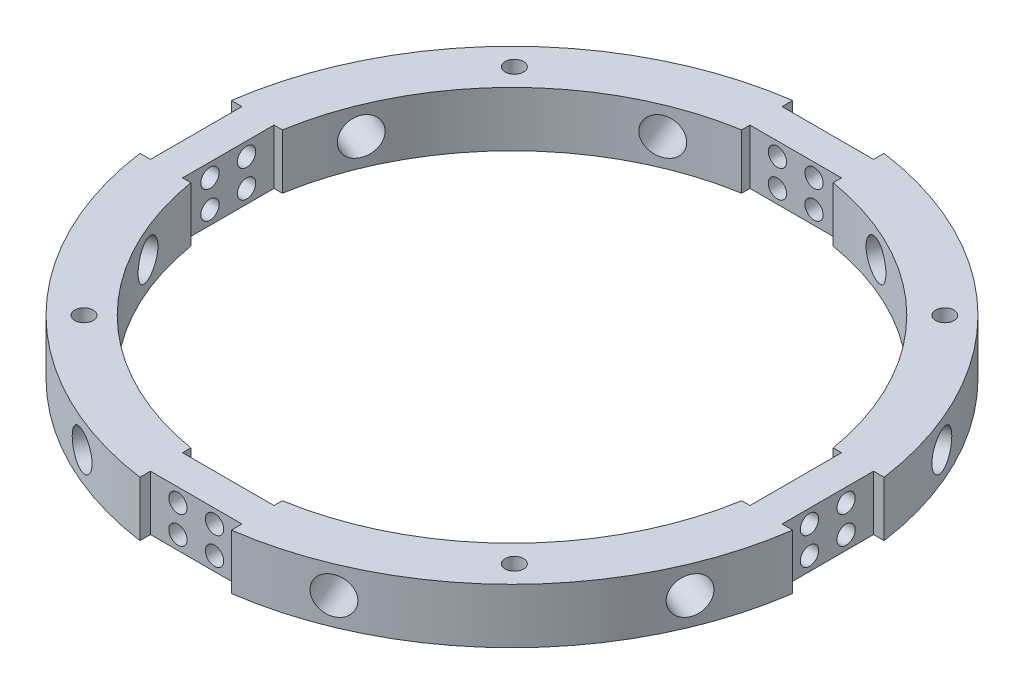
from build123d import *

# Parameters (mm, degrees)
BOSS_EXTRUDE1_DEPTH      = 6
BOSS_EXTRUDE1_DEPTH_BACK = 6
SKETCH1_R                = 72
SKETCH1_R_2              = 61
SKETCH5_R                = 2
CUT_EXTRUDE3_DEPTH       = 103.528044944
SKETCH6_W                = 20
SKETCH6_H                = 3
SKETCH6_W_2              = 3
SKETCH6_H_2              = 20
CUT_EXTRUDE4_DEPTH       = 103.528044944
SKETCH12_R               = 2
CUT_EXTRUDE8_DEPTH       = 158.495079274
SKETCH13_W               = 20
SKETCH13_H               = 3
SKETCH13_W_2             = 3
SKETCH13_H_2             = 20
CUT_EXTRUDE9_DEPTH       = 102.54801821
SKETCH15_R               = 4
CUT_EXTRUDE10_DEPTH      = 227.8695061
SKETCH16_R               = 4
CUT_EXTRUDE11_DEPTH      = 227.869506244
SKETCH17_R               = 4
CUT_EXTRUDE12_DEPTH      = 227.869506244
SKETCH18_R               = 4
CUT_EXTRUDE13_DEPTH      = 227.869506244
SKETCH19_R               = 2
CUT_EXTRUDE14_DEPTH      = 158.495079412


with BuildPart() as part:
    # Sketch1 → Boss-Extrude1 (new, two sides: drawn at the far end of the back side and taken through both)
    with BuildSketch(Plane(origin=(0, 0, 0), x_dir=(1, 0, 0), z_dir=(0, 1, 0)).offset(-BOSS_EXTRUDE1_DEPTH_BACK)):
        Circle(SKETCH1_R)
        Circle(SKETCH1_R_2, mode=Mode.SUBTRACT)
    extrude(amount=BOSS_EXTRUDE1_DEPTH + BOSS_EXTRUDE1_DEPTH_BACK)

    # Sketch5 → Cut-Extrude3 (cut, through all)
    with BuildSketch(Plane(origin=(0, 6, 0), x_dir=(1, 0, 0), z_dir=(0, 1, 0))):
        with Locations((47.284209037, 47.284209037)):
            Circle(SKETCH5_R)
        with Locations((47.284209037, -46.760992861)):
            Circle(SKETCH5_R)
        with Locations((-46.760992861, -46.760992861)):
            Circle(SKETCH5_R)
        with Locations((-46.760992861, 47.284209037)):
            Circle(SKETCH5_R)
    extrude(amount=-CUT_EXTRUDE3_DEPTH, mode=Mode.SUBTRACT)

    # Sketch6 → Cut-Extrude4 (cut, through all)
    with BuildSketch(Plane(origin=(0, 6, 0), x_dir=(1, 0, 0), z_dir=(0, 1, 0))):
        with Locations((0, -70.5)):
            Rectangle(SKETCH6_W, SKETCH6_H)
        with Locations((0, 70.5)):
            Rectangle(SKETCH6_W, SKETCH6_H)
        with Locations((70.5, 0)):
            Rectangle(SKETCH6_W_2, SKETCH6_H_2)
        with Locations((-70.5, 0)):
            Rectangle(SKETCH6_W_2, SKETCH6_H_2)
    extrude(amount=-CUT_EXTRUDE4_DEPTH, mode=Mode.SUBTRACT)

    # Sketch12 → Cut-Extrude8 (cut, through all)
    with BuildSketch(Plane.XY.offset(69)):
        with Locations((4, 3)):
            Circle(SKETCH12_R)
        with Locations((-4, 3)):
            Circle(SKETCH12_R)
        with Locations((4, -3)):
            Circle(SKETCH12_R)
        with Locations((-4, -3)):
            Circle(SKETCH12_R)
    extrude(amount=-CUT_EXTRUDE8_DEPTH, mode=Mode.SUBTRACT)

    # Sketch13 → Cut-Extrude9 (cut, through all)
    with BuildSketch(Plane(origin=(0, 6, 0), x_dir=(1, 0, 0), z_dir=(0, 1, 0))):
        with Locations((0, -60.5)):
            Rectangle(SKETCH13_W, SKETCH13_H)
        with Locations((0, 60.5)):
            Rectangle(SKETCH13_W, SKETCH13_H)
        with Locations((-60.5, 0)):
            Rectangle(SKETCH13_W_2, SKETCH13_H_2)
        with Locations((60.5, 0)):
            Rectangle(SKETCH13_W_2, SKETCH13_H_2)
    extrude(amount=-CUT_EXTRUDE9_DEPTH, mode=Mode.SUBTRACT)

    # Sketch15 → Cut-Extrude10 (cut, through all)
    with BuildSketch(Plane(origin=(-49.779681973, 6, -120.17878335), x_dir=(-0.9238795325112865, 0, 0.3826834323650906), z_dir=(-0.3826834323650906, 0, -0.9238795325112865))):
        with Locations((0, -6)):
            Circle(SKETCH15_R)
    extrude(amount=-CUT_EXTRUDE10_DEPTH, mode=Mode.SUBTRACT)

    # Sketch16 → Cut-Extrude11 (cut, through all)
    with BuildSketch(Plane(origin=(-120.17878335, 6, -49.779681973), x_dir=(-0.3826834323650807, 0, 0.9238795325112905), z_dir=(-0.9238795325112905, 0, -0.3826834323650807))):
        with Locations((0, -6)):
            Circle(SKETCH16_R)
    extrude(amount=-CUT_EXTRUDE11_DEPTH, mode=Mode.SUBTRACT)

    # Sketch17 → Cut-Extrude12 (cut, through all)
    with BuildSketch(Plane(origin=(-120.17878335, 6, 49.779681973), x_dir=(0.3826834323650807, 0, 0.9238795325112905), z_dir=(-0.9238795325112905, 0, 0.3826834323650807))):
        with Locations((0, -6)):
            Circle(SKETCH17_R)
    extrude(amount=-CUT_EXTRUDE12_DEPTH, mode=Mode.SUBTRACT)

    # Sketch18 → Cut-Extrude13 (cut, through all)
    with BuildSketch(Plane(origin=(-49.779681973, 6, 120.17878335), x_dir=(0.9238795325112865, 0, 0.3826834323650906), z_dir=(-0.3826834323650906, 0, 0.9238795325112865))):
        with Locations((0, -6)):
            Circle(SKETCH18_R)
    extrude(amount=-CUT_EXTRUDE13_DEPTH, mode=Mode.SUBTRACT)

    # Sketch19 → Cut-Extrude14 (cut, through all)
    with BuildSketch(Plane(origin=(69, 0, 0), x_dir=(0, 0, -1), z_dir=(1, 0, 0))):
        with Locations((4, 3)):
            Circle(SKETCH19_R)
        with Locations((-4, 3)):
            Circle(SKETCH19_R)
        with Locations((4, -3)):
            Circle(SKETCH19_R)
        with Locations((-4, -3)):
            Circle(SKETCH19_R)
    extrude(amount=-CUT_EXTRUDE14_DEPTH, mode=Mode.SUBTRACT)


solid = part.part
